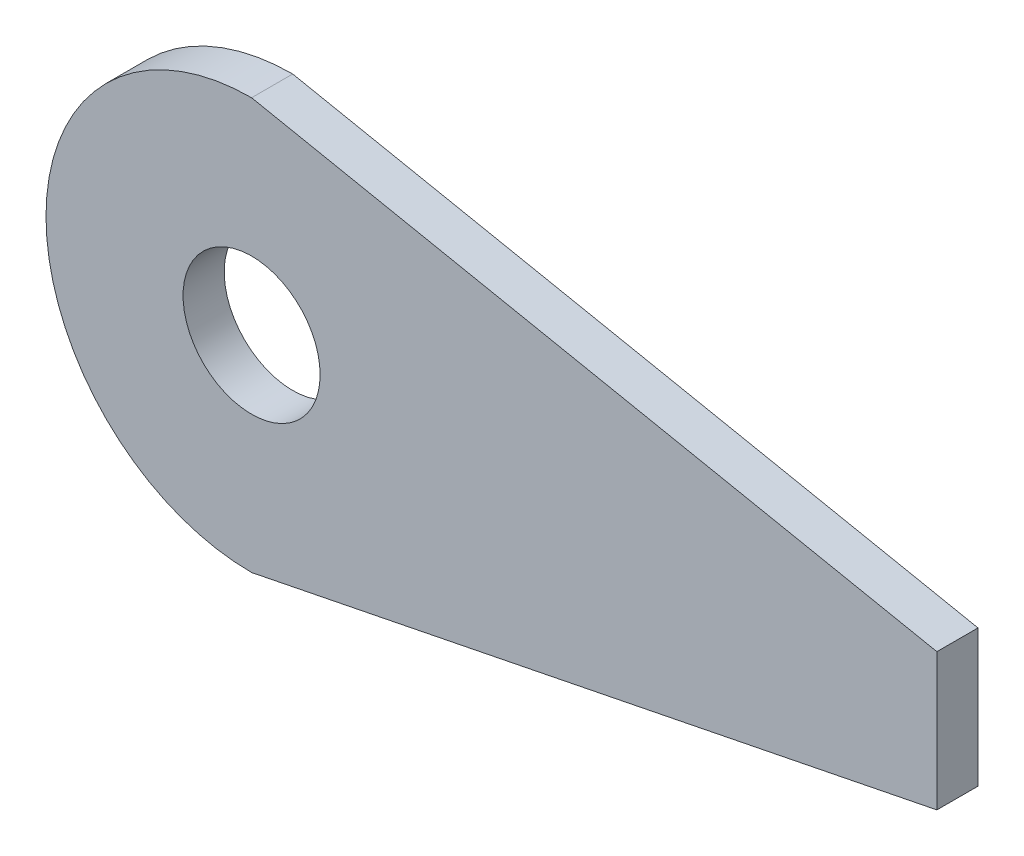
from build123d import *

# Parameters (mm, degrees)
SKETCH1_R           = 5
BOSS_EXTRUDE1_DEPTH = 3


with BuildPart() as part:
    # Sketch1 → Boss-Extrude1 (new body)
    with BuildSketch(Plane.XY):
        with BuildLine():
            Line((0, 15), (50, 5))
            Line((50, 5), (50, -5))
            Line((50, -5), (0, -15))
            ThreePointArc((0, -15), (-15, 0), (0, 15))
        make_face()
        Circle(SKETCH1_R, mode=Mode.SUBTRACT)
    extrude(amount=BOSS_EXTRUDE1_DEPTH)


solid = part.part
